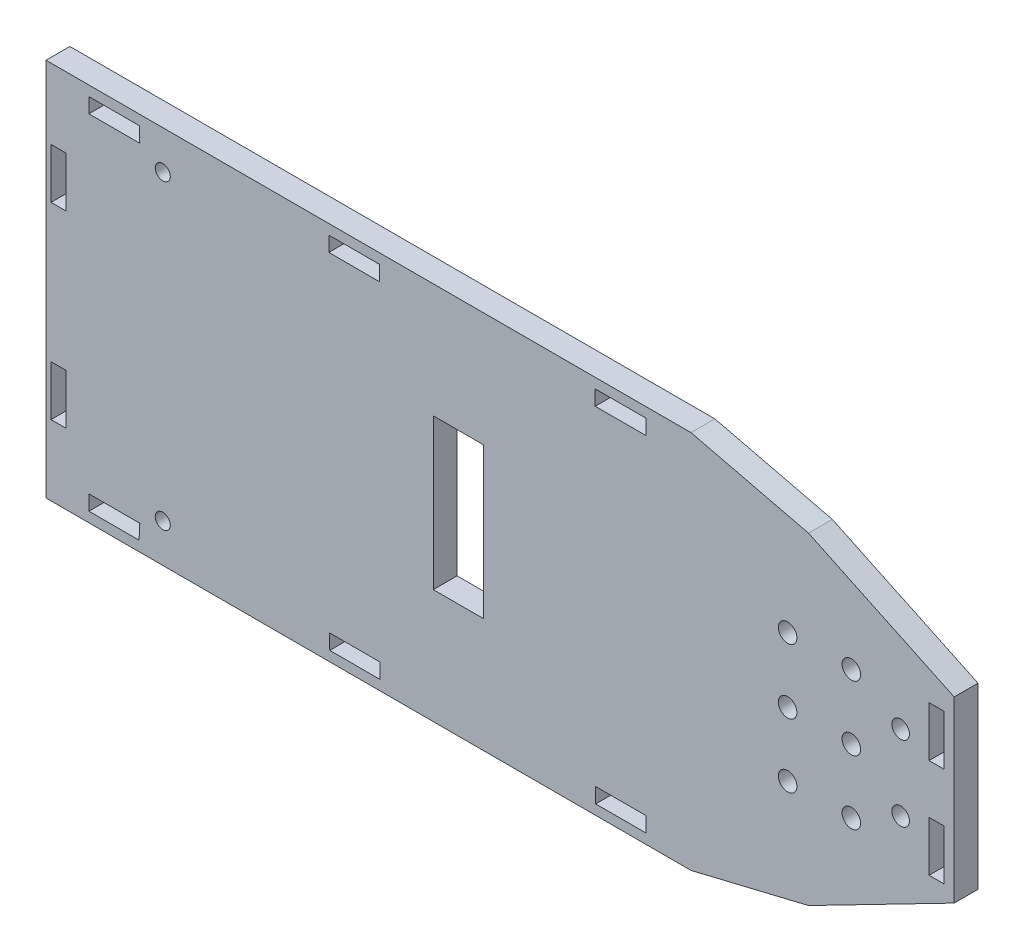
from build123d import *

# Parameters (mm, degrees)
SKETCH1_W           = 181
SKETCH1_H           = 75.57
BOSS_EXTRUDE2_DEPTH = 4.75
SKETCH6_W           = 3
SKETCH6_H           = 10
SKETCH6_W_2         = 10.095812656
SKETCH6_H_2         = 3.003442242
SKETCH6_W_3         = 10
SKETCH6_H_3         = 30
SKETCH6_R           = 1.5
SKETCH6_R_2         = 1.85
SKETCH6_R_3         = 1.75
CUT_EXTRUDE7_DEPTH  = 9


with BuildPart() as part:
    # Sketch1 → Boss-Extrude2 (new body)
    with BuildSketch(Plane.XY):
        Rectangle(SKETCH1_W, SKETCH1_H)
    extrude(amount=BOSS_EXTRUDE2_DEPTH)

    # Sketch6 → Cut-Extrude7 (cut)
    with BuildSketch(Plane.XY.offset(4.75)):
        Polygon((-81.955185068, 35.785), (-81.955183992, 32.802018857), (-71.81277502, 32.798644215), (-71.859372412, 35.785), align=None)
        with Locations((-88, 18.75)):
            Rectangle(SKETCH6_W, SKETCH6_H)
        with Locations((-88, -18.75)):
            Rectangle(SKETCH6_W, SKETCH6_H)
        Polygon((-34.13878131, 35.785), (-34.130786214, 32.798291399), (-24.042968654, 32.781557758), (-24.042968654, 35.785), align=None)
        Polygon((-71.81277502, -32.788413815), (-81.955183992, -32.785039173), (-81.955181828, -35.785039173), (-71.955181828, -35.785031959), align=None)
        Polygon((-33.95518398, -32.801010013), (-33.947153334, -35.800999264), (-23.947156396, -35.808824865), (-23.946905936, -32.804340026), align=None)
        with Locations((87, 9.9)):
            Rectangle(SKETCH6_W, SKETCH6_H)
        with Locations((24.004937674, 34.283278879)):
            Rectangle(SKETCH6_W_2, SKETCH6_H_2)
        Polygon((29.052844002, -32.806257253), (19.053094123, -32.805423656), (19.052844037, -35.805423646), (29.052844002, -35.806257264), align=None)
        with Locations((-8.31156853, 0)):
            Rectangle(SKETCH6_W_3, SKETCH6_H_3)
        with Locations((87, -9.9)):
            Rectangle(SKETCH6_W, SKETCH6_H)
        Polygon((61.466273892, -32.14), (38.055212144, -37.785), (90.5, -37.785), (90.5, -17.2), align=None)
        Polygon((61.46627389, 32.14), (90.5, 18.385572572), (90.5, 37.785), (38.055212144, 37.785), align=None)
        with Locations((-67.23, 30.095)):
            Circle(SKETCH6_R)
        with Locations((-67.23, -30.095)):
            Circle(SKETCH6_R)
        with Locations((70.00651733, -12.753407437)):
            Circle(SKETCH6_R_2)
        with Locations((70.00651733, 12.892480558)):
            Circle(SKETCH6_R_2)
        with Locations((70.00651733, 0)):
            Circle(SKETCH6_R_2)
        with Locations((57.30651733, 12.892480558)):
            Circle(SKETCH6_R_2)
        with Locations((57.30651733, 0)):
            Circle(SKETCH6_R_2)
        with Locations((57.30651733, -12.753407437)):
            Circle(SKETCH6_R_2)
        with Locations((79.833359723, -7.5)):
            Circle(SKETCH6_R_3)
        with Locations((79.833359723, 7.5)):
            Circle(SKETCH6_R_3)
    extrude(amount=-CUT_EXTRUDE7_DEPTH, mode=Mode.SUBTRACT)


solid = part.part
